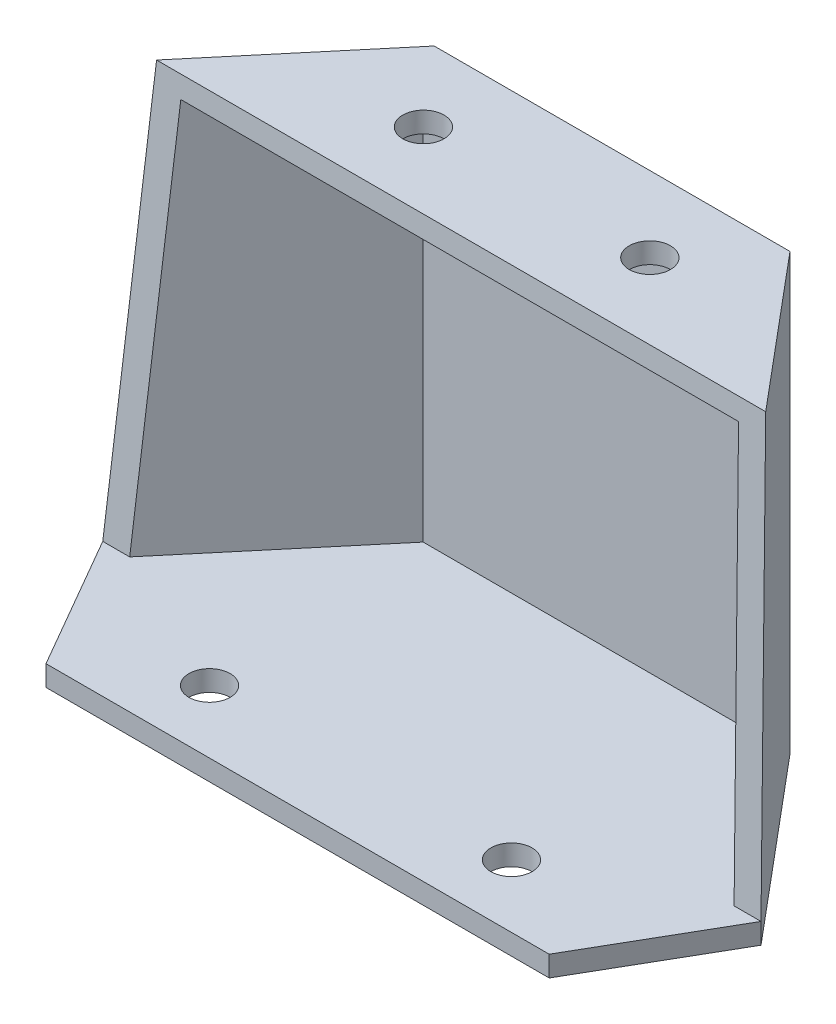
from build123d import *

# Parameters (mm, degrees)
EXTRUDE_1_DEPTH          = 211
SHELL_1_T                = 10
CUT_EXTRUDE_1_DEPTH      = 306.363666708
CUT_EXTRUDE_1_DEPTH_BACK = 306.363666708
CUT_EXTRUDE_2_REACH      = 307.364
SKETCH_3_R               = 10
CUT_EXTRUDE_3_REACH      = 300.541
SKETCH_4_R               = 10


with BuildPart() as part:
    # 草图1 → 凸台-拉伸1 (new body)
    with BuildSketch(Plane(origin=(0, 0, 0), x_dir=(1, 0, 0), z_dir=(0, 1, 0))):
        Polygon((122, 0), (-122, 0), (-159.592352403, 65.111864338), (-86.265, 152.5), (86.265, 152.5), (159.592352403, 65.111864338), align=None)
    extrude(amount=EXTRUDE_1_DEPTH)

    # 抽壳1 (no face opened: a closed hollow body)
    add(offset(amount=-SHELL_1_T, mode=Mode.PRIVATE), mode=Mode.SUBTRACT)

    # 草图2 → 切除-拉伸1 (cut, two sides: drawn at the far end of the back side and taken through both)
    with BuildSketch(Plane(origin=(0, 0, 0), x_dir=(0, 0, -1), z_dir=(1, 0, 0)).offset(-CUT_EXTRUDE_1_DEPTH_BACK)):
        Polygon((79.3, 211), (65.111864338, 10), (0, 10), (0, 211), align=None)
    extrude(amount=CUT_EXTRUDE_1_DEPTH + CUT_EXTRUDE_1_DEPTH_BACK, mode=Mode.SUBTRACT)

    # 草图3 → 切除-拉伸2 (cut, up to next)
    with BuildSketch(Plane(origin=(0, 211, 0), x_dir=(1, 0, 0), z_dir=(0, 1, 0)), mode=Mode.PRIVATE) as cut_extrude_2_sk1:
        with Locations(Location((-54.9, 115.9, 0), (0, 0, 270))):
            Circle(SKETCH_3_R)
    cut_extrude_2_tool1 = extrude(cut_extrude_2_sk1.sketch, amount=-CUT_EXTRUDE_2_REACH, mode=Mode.PRIVATE) & part.part
    # 草图3 → 切除-拉伸2 (cut, up to next)
    with BuildSketch(Plane(origin=(0, 211, 0), x_dir=(1, 0, 0), z_dir=(0, 1, 0)), mode=Mode.PRIVATE) as cut_extrude_2_sk2:
        with Locations(Location((54.9, 115.9, 0), (0, 0, 270))):
            Circle(SKETCH_3_R)
    cut_extrude_2_tool2 = extrude(cut_extrude_2_sk2.sketch, amount=-CUT_EXTRUDE_2_REACH, mode=Mode.PRIVATE) & part.part
    add(cut_extrude_2_tool1.solids().sort_by_distance((-54.9, 211, -115.9))[0], mode=Mode.SUBTRACT)
    add(cut_extrude_2_tool2.solids().sort_by_distance((54.9, 211, -115.9))[0], mode=Mode.SUBTRACT)

    # 草图4 → 切除-拉伸3 (cut, up to next)
    with BuildSketch(Plane(origin=(0, 10, 0), x_dir=(1, 0, 0), z_dir=(0, 1, 0)), mode=Mode.PRIVATE) as cut_extrude_3_sk1:
        with Locations(Location((-73.2, 30.5, 0), (0, 0, 270))):
            Circle(SKETCH_4_R)
    cut_extrude_3_tool1 = extrude(cut_extrude_3_sk1.sketch, amount=-CUT_EXTRUDE_3_REACH, mode=Mode.PRIVATE) & part.part
    # 草图4 → 切除-拉伸3 (cut, up to next)
    with BuildSketch(Plane(origin=(0, 10, 0), x_dir=(1, 0, 0), z_dir=(0, 1, 0)), mode=Mode.PRIVATE) as cut_extrude_3_sk2:
        with Locations(Location((73.2, 30.5, 0), (0, 0, 270))):
            Circle(SKETCH_4_R)
    cut_extrude_3_tool2 = extrude(cut_extrude_3_sk2.sketch, amount=-CUT_EXTRUDE_3_REACH, mode=Mode.PRIVATE) & part.part
    add(cut_extrude_3_tool1.solids().sort_by_distance((-73.2, 10, -30.5))[0], mode=Mode.SUBTRACT)
    add(cut_extrude_3_tool2.solids().sort_by_distance((73.2, 10, -30.5))[0], mode=Mode.SUBTRACT)


solid = part.part
